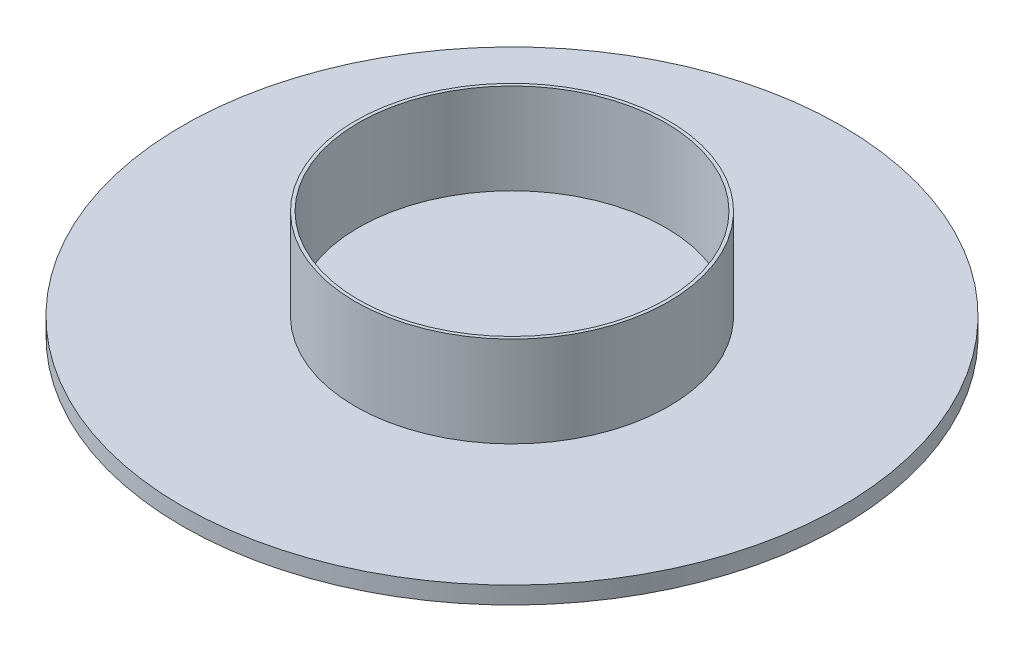
from build123d import *

# Parameters (mm, degrees)
SKETCH_1_R      = 30.5
EXTRUDE_1_DEPTH = 1.6
SKETCH_2_R      = 14.5
SKETCH_2_R_2    = 14.2
EXTRUDE_2_DEPTH = 10
SKETCH_3_R      = 17.7
SKETCH_3_R_2    = 14.2
EXTRUDE_3_DEPTH = 0.8


with BuildPart() as part:
    # 스케치1 → 보스-돌출1 (new body)
    with BuildSketch(Plane(origin=(0, 0, 0), x_dir=(1, 0, 0), z_dir=(0, 1, 0))):
        with Locations(Location((0, 0, 0), (0, 0, 270))):
            Circle(SKETCH_1_R)
    extrude(amount=EXTRUDE_1_DEPTH)

    # 스케치2 → 보스-돌출2 (add)
    with BuildSketch(Plane(origin=(0, 0, 0), x_dir=(1, 0, 0), z_dir=(0, 1, 0))):
        with Locations(Location((0, 0, 0), (0, 0, 270))):
            Circle(SKETCH_2_R)
        with Locations(Location((0, 0, 0), (0, 0, 270))):
            Circle(SKETCH_2_R_2, mode=Mode.SUBTRACT)
    extrude(amount=EXTRUDE_2_DEPTH)


with BuildPart() as body_2:
    # 스케치3 → 보스-돌출3 (new body)
    with BuildSketch(Plane(origin=(0, 0, 0), x_dir=(1, 0, 0), z_dir=(0, 1, 0))):
        with Locations(Location((0, 0, 0), (0, 0, 270))):
            Circle(SKETCH_3_R)
        with Locations(Location((0, 0, 0), (0, 0, 270))):
            Circle(SKETCH_3_R_2, mode=Mode.SUBTRACT)
    extrude(amount=-EXTRUDE_3_DEPTH)


solid = Compound([part.part, body_2.part])
